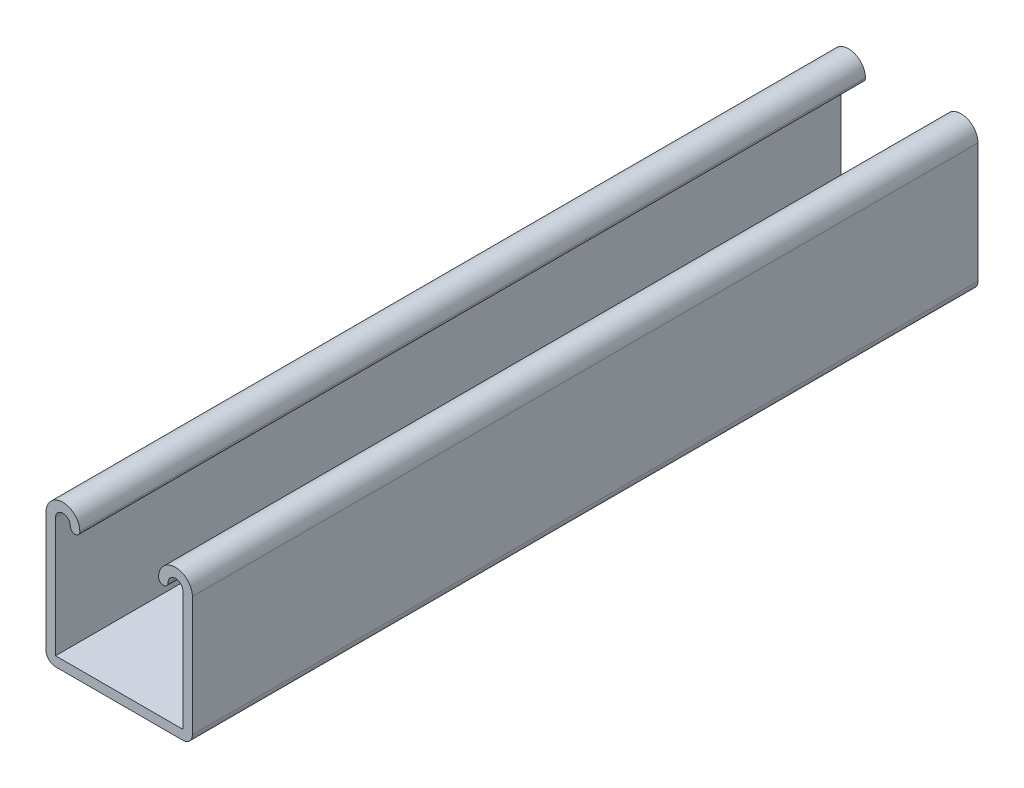
from build123d import *

# Parameters (mm, degrees)
EXTRUDE_1_DEPTH = 221.996


with BuildPart() as part:
    # 草图1 → 凸台-拉伸1 (new body)
    with BuildSketch(Plane.XY):
        with BuildLine():
            Line((0, 0), (35.98, 0))
            ThreePointArc((35.98, 0), (37.883814298, 0.788585702), (38.6724, 2.6924))
            Line((38.6724, 2.6924), (38.6724, 36.5252))
            ThreePointArc((38.6724, 36.5252), (33.8972, 41.3004), (29.122, 36.5252))
            ThreePointArc((29.122, 36.5252), (30.4682, 35.179), (31.8144, 36.5252))
            ThreePointArc((31.8144, 36.5252), (33.8972, 38.608), (35.98, 36.5252))
            Line((35.98, 36.5252), (35.98, 2.6924))
            Line((35.98, 2.6924), (0, 2.6924))
            Line((0, 2.6924), (0, 36.5252))
            ThreePointArc((0, 36.5252), (2.0828, 38.608), (4.1656, 36.5252))
            ThreePointArc((4.1656, 36.5252), (5.5118, 35.179), (6.858, 36.5252))
            ThreePointArc((6.858, 36.5252), (2.0828, 41.3004), (-2.6924, 36.5252))
            Line((-2.6924, 36.5252), (-2.6924, 2.6924))
            ThreePointArc((-2.6924, 2.6924), (-1.903814298, 0.788585702), (0, 0))
        make_face()
    extrude(amount=EXTRUDE_1_DEPTH)


solid = part.part
